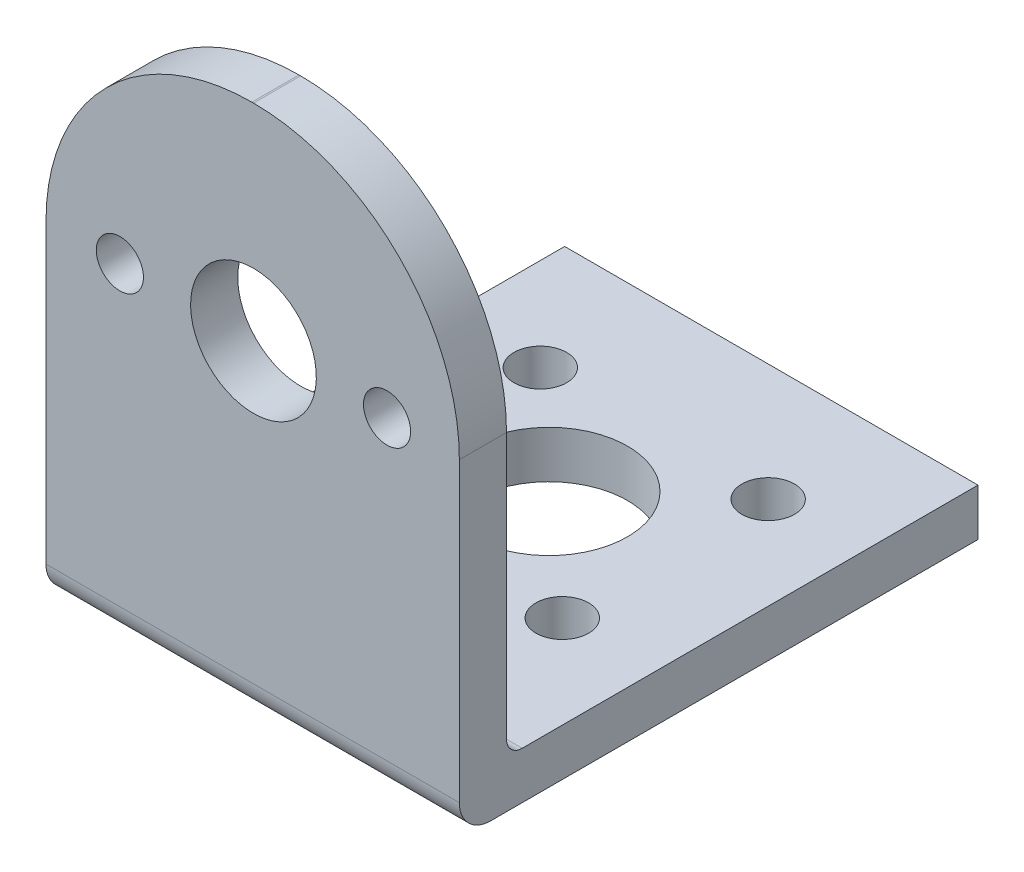
from build123d import *

# Parameters (mm, degrees)
SALIENTE_EXTRUIR1_DEPTH = 26.3
REDONDEO1_R             = 1
REDONDEO2_R             = 2
REDONDEO3_R             = 13.1
CROQUIS2_R              = 5
CROQUIS2_R_2            = 1.675
CORTAR_EXTRUIR1_DEPTH   = 45.161663239
CROQUIS3_R              = 4
CROQUIS3_R_2            = 1.5
CORTAR_EXTRUIR2_DEPTH   = 50.313121927


with BuildPart() as part:
    # Croquis1 → Saliente-Extruir1 (new body)
    with BuildSketch(Plane(origin=(0, 0, 0), x_dir=(0, 0, -1), z_dir=(1, 0, 0))):
        Polygon((-17.25, 28.984375), (-14.25, 28.984375), (-14.25, -2.015625), (15.75, -2.015625), (15.75, -5.015625), (-17.25, -5.015625), align=None)
    extrude(amount=SALIENTE_EXTRUIR1_DEPTH)

    # Redondeo1
    redondeo1_edges = [part.edges().sort_by_distance(p)[0] for p in [
        (13.15, -2.015625, 14.25),
    ]]
    fillet(redondeo1_edges, radius=REDONDEO1_R)

    # Redondeo2
    redondeo2_edges = [part.edges().sort_by_distance(p)[0] for p in [
        (13.15, -5.015625, 17.25),
    ]]
    fillet(redondeo2_edges, radius=REDONDEO2_R)

    # Redondeo3
    redondeo3_edges = [part.edges().sort_by_distance(p)[0] for p in [
        (26.3, 28.984375, 15.75),
        (0, 28.984375, 15.75),
    ]]
    fillet(redondeo3_edges, radius=REDONDEO3_R)

    # Croquis2 → Cortar-Extruir1 (cut, through all)
    with BuildSketch(Plane(origin=(0, -2.015625, 0), x_dir=(1, 0, 0), z_dir=(0, 1, 0))):
        with Locations(Location((13, 1.75, 0), (0, 0, 270))):
            Circle(CROQUIS2_R)
        with Locations(Location((5.9, 8.3, 0), (0, 0, 270))):
            Circle(CROQUIS2_R_2)
        with Locations(Location((20.4, 8.3, 0), (0, 0, 270))):
            Circle(CROQUIS2_R_2)
        with Locations(Location((20.4, -4.8, 0), (0, 0, 270))):
            Circle(CROQUIS2_R_2)
        with Locations(Location((5.9, -4.8, 0), (0, 0, 270))):
            Circle(CROQUIS2_R_2)
    extrude(amount=-CORTAR_EXTRUIR1_DEPTH, mode=Mode.SUBTRACT)

    # Croquis3 → Cortar-Extruir2 (cut, through all)
    with BuildSketch(Plane(origin=(0, 0, 14.25), x_dir=(-1, 0, 0), z_dir=(0, 0, -1))):
        with Locations(Location((-13.2, 15.884375, 0), (0, 0, 90))):
            Circle(CROQUIS3_R)
        with Locations(Location((-21.7, 15.884375, 0), (0, 0, 90))):
            Circle(CROQUIS3_R_2)
        with Locations(Location((-4.7, 15.884375, 0), (0, 0, 90))):
            Circle(CROQUIS3_R_2)
    extrude(amount=-CORTAR_EXTRUIR2_DEPTH, mode=Mode.SUBTRACT)


solid = part.part
